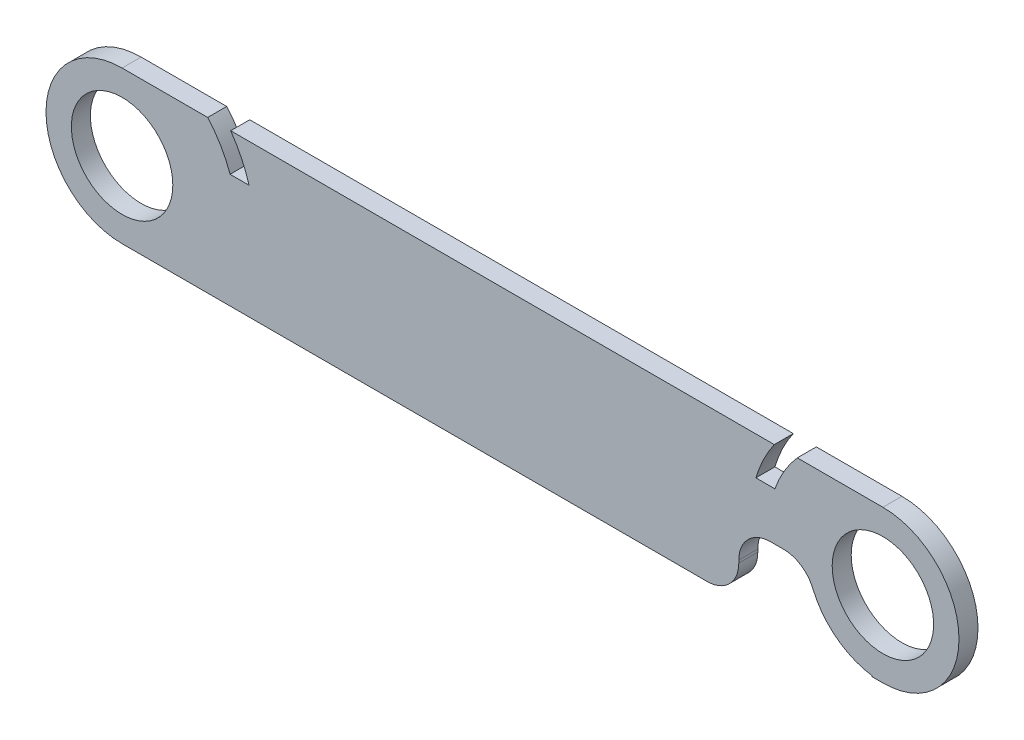
from build123d import *

# Parameters (mm, degrees)
SKETCH1_R           = 8
BOSS_EXTRUDE1_DEPTH = 3
CUT_EXTRUDE1_DEPTH  = 133.578278764
CUT_EXTRUDE8_DEPTH  = 10
FILLET2_R           = 5
FILLET3_R           = 5
FILLET4_R           = 5


with BuildPart() as part:
    # Sketch1 → Boss-Extrude1 (new body)
    with BuildSketch(Plane.XY):
        with BuildLine():
            Line((0, -12), (-120, -12))
            ThreePointArc((-120, -12), (-132, 0), (-120, 12))
            Line((-120, 12), (0, 12))
            ThreePointArc((0, 12), (12, 0), (0, -12))
        make_face()
        with Locations((-120, 0)):
            Circle(SKETCH1_R, mode=Mode.SUBTRACT)
        with Locations(Location((0, 0, 0), (0, 0, 180))):
            Circle(SKETCH1_R, mode=Mode.SUBTRACT)
    extrude(amount=BOSS_EXTRUDE1_DEPTH)

    # Sketch2 → Cut-Extrude1 (cut, through all)
    with BuildSketch(Plane.XY.offset(3)):
        with BuildLine():
            Line((-17.036725037, 6), (-20.036725037, 6))
            ThreePointArc((-20.036725037, 6), (-18.824439071, 9.116514898), (-17.130976336, 12))
            Line((-17.130976336, 12), (-13.5, 12))
            ThreePointArc((-13.5, 12), (-15.560298648, 9.172082969), (-17.036725037, 6))
        make_face()
        with BuildLine():
            Line((-102.963274963, 6), (-99.963274963, 6))
            ThreePointArc((-99.963274963, 6), (-101.175560929, 9.116514898), (-102.869023664, 12))
            Line((-102.869023664, 12), (-106.5, 12))
            ThreePointArc((-106.5, 12), (-104.439701352, 9.172082969), (-102.963274963, 6))
        make_face()
    extrude(amount=-CUT_EXTRUDE1_DEPTH, mode=Mode.SUBTRACT)

    # Sketch5 → Cut-Extrude8 (cut)
    with BuildSketch(Plane.XY.offset(3)):
        with BuildLine():
            Line((-1.731193523, -11.858337769), (-1.731193523, -12))
            Line((-1.731193523, -12), (-22.731193523, -12))
            Line((-22.731193523, -12), (-22.731193523, -2.344249067))
            Line((-22.731193523, -2.344249067), (-22.731193523, -1.572214532))
            Line((-22.731193523, -1.572214532), (-11.880460729, -1.572214532))
            ThreePointArc((-11.880460729, -1.572214532), (-8.530554828, -8.417056492), (-1.731193523, -11.858337769))
        make_face()
    extrude(amount=-CUT_EXTRUDE8_DEPTH, mode=Mode.SUBTRACT)

    # Fillet2
    fillet2_edges = [part.edges().sort_by_distance(p)[0] for p in [
        (-22.731193523, -1.572214532, 1.5),
    ]]
    fillet(fillet2_edges, radius=FILLET2_R)

    # Fillet3
    fillet3_edges = [part.edges().sort_by_distance(p)[0] for p in [
        (-11.880460729, -1.572214532, 1.5),
    ]]
    fillet(fillet3_edges, radius=FILLET3_R)

    # Fillet4
    fillet4_edges = [part.edges().sort_by_distance(p)[0] for p in [
        (-22.731193523, -12, 1.5),
    ]]
    fillet(fillet4_edges, radius=FILLET4_R)


solid = part.part
